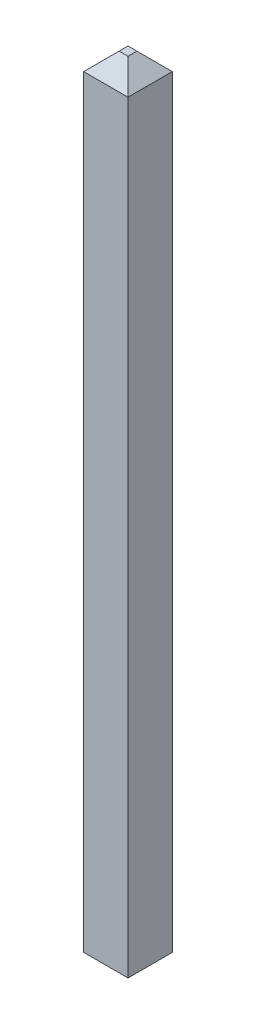
from build123d import *

# Parameters (mm, degrees)
SKETCH1_W           = 0.635
SKETCH1_H           = 0.635
BOSS_EXTRUDE1_DEPTH = 11.43
CHAMFER1_SIZE       = 0.254
CHAMFER2_SIZE       = 0.254


with BuildPart() as part:
    # Sketch1 → Boss-Extrude1 (new body)
    with BuildSketch(Plane(origin=(0, 0, 0), x_dir=(1, 0, 0), z_dir=(0, 1, 0))):
        Rectangle(SKETCH1_W, SKETCH1_H)
    extrude(amount=BOSS_EXTRUDE1_DEPTH)

    # Chamfer1
    chamfer1_edges = [part.edges().sort_by_distance(p)[0] for p in [
        (0.3175, 11.43, 0),
        (0, 11.43, -0.3175),
        (-0.3175, 11.43, 0),
        (0, 11.43, 0.3175),
    ]]
    chamfer(chamfer1_edges, length=CHAMFER1_SIZE)

    # Chamfer2
    chamfer2_edges = [part.edges().sort_by_distance(p)[0] for p in [
        (0, 0, -0.3175),
        (0.3175, 0, 0),
        (0, 0, 0.3175),
        (-0.3175, 0, 0),
    ]]
    chamfer(chamfer2_edges, length=CHAMFER2_SIZE)


solid = part.part
